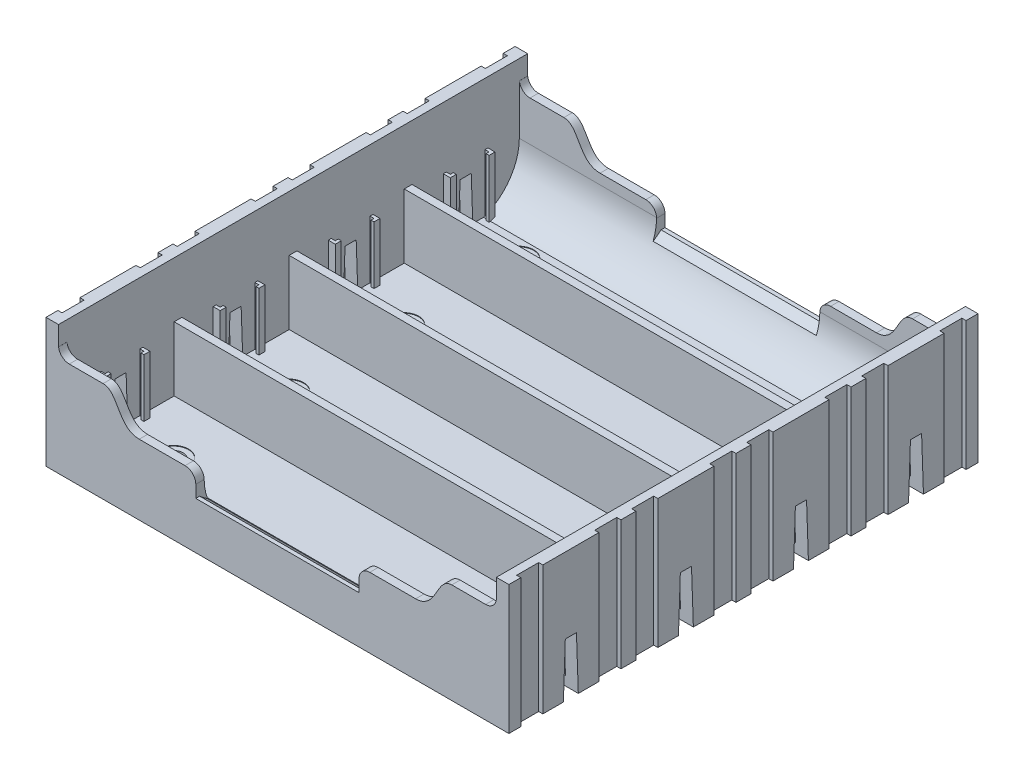
from build123d import *

# Parameters (mm, degrees)
EXTRUDE_1_DEPTH                  = 10.4
CUT_EXTRUDE_1_DEPTH              = 77.481335112
CUT_EXTRUDE_START                = -23.03
SKETCH_3_R                       = 15
CUT_EXTRUDE_2_DEPTH              = 27.39
SKETCH_17_W                      = 73.45
SKETCH_17_H                      = 1.574923167
EXTRUDE_12_DEPTH                 = 28.95
EXTRUDE_8_DEPTH                  = 21.65
EXTRUDE_9_DEPTH                  = 11.28
SKETCH_16_W                      = 3.39091882
SKETCH_16_H                      = 2.5
CUT_EXTRUDE_5_DEPTH              = 9
CUT_EXTRUDE_5_DRAFT              = -2
CUT_EXTRUDE_5_PROFILE_2_DEPTH    = 9
CUT_EXTRUDE_5_PROFILE_2_DRAFT    = -2
SKETCH_18_R                      = 1.6
CUT_EXTRUDE_6_DEPTH              = 9
SKETCH_21_R                      = 2.5
CUT_EXTRUDE_9_DEPTH              = 0.1
PATTERN_LINEAR_1_COUNT           = 4
PATTERN_LINEAR_1_PITCH           = 19.3
PATTERN_LINEAR_1_COPY_1_SKETCH_W = 3.39091882
PATTERN_LINEAR_1_COPY_1_SKETCH_H = 2.5
PATTERN_LINEAR_1_COPY_1_DEPTH    = 9
PATTERN_LINEAR_1_COPY_1_DRAFT    = -2
PATTERN_LINEAR_1_COPY_2_SKETCH_W = 3.39091882
PATTERN_LINEAR_1_COPY_2_SKETCH_H = 2.5
PATTERN_LINEAR_1_COPY_2_DEPTH    = 9
PATTERN_LINEAR_1_COPY_2_DRAFT    = -2
PATTERN_LINEAR_1_COPY_3_SKETCH_W = 3.39091882
PATTERN_LINEAR_1_COPY_3_SKETCH_H = 2.5
PATTERN_LINEAR_1_COPY_3_DEPTH    = 9
PATTERN_LINEAR_1_COPY_3_DRAFT    = -2
PATTERN_LINEAR_1_COPY_4_SKETCH_W = 3.39091882
PATTERN_LINEAR_1_COPY_4_SKETCH_H = 2.5
PATTERN_LINEAR_1_COPY_4_DEPTH    = 9
PATTERN_LINEAR_1_COPY_4_DRAFT    = -2
PATTERN_LINEAR_1_COPY_5_SKETCH_W = 3.39091882
PATTERN_LINEAR_1_COPY_5_SKETCH_H = 2.5
PATTERN_LINEAR_1_COPY_5_DEPTH    = 9
PATTERN_LINEAR_1_COPY_5_DRAFT    = -2
PATTERN_LINEAR_1_COPY_6_SKETCH_W = 3.39091882
PATTERN_LINEAR_1_COPY_6_SKETCH_H = 2.5
PATTERN_LINEAR_1_COPY_6_DEPTH    = 9
PATTERN_LINEAR_1_COPY_6_DRAFT    = -2
PATTERN_LINEAR_1_COPY_7_SKETCH_W = 3.39091882
PATTERN_LINEAR_1_COPY_7_SKETCH_H = 2.5
PATTERN_LINEAR_1_COPY_7_DEPTH    = 9
PATTERN_LINEAR_1_COPY_7_DRAFT    = -2
PATTERN_LINEAR_1_COPY_8_SKETCH_W = 3.39091882
PATTERN_LINEAR_1_COPY_8_SKETCH_H = 2.5
PATTERN_LINEAR_1_COPY_8_DEPTH    = 9
PATTERN_LINEAR_1_COPY_8_DRAFT    = -2
PATTERN_LINEAR_1_COPY_9_SKETCH_W = 3.39091882
PATTERN_LINEAR_1_COPY_9_SKETCH_H = 2.5
PATTERN_LINEAR_1_COPY_9_DEPTH    = 9
PATTERN_LINEAR_1_COPY_9_DRAFT    = -2
EXTRUDE_START                    = -9.3
SKETCH_13_W                      = 76.887886028
SKETCH_13_H                      = 1.3
EXTRUDE_10_DEPTH                 = 10.775076833
PATTERN_LINEAR_4_COUNT           = 3
PATTERN_LINEAR_4_PITCH           = 19.3


with BuildPart() as part:
    # Эскиз1 → Бобышка-Вытянуть1 (new body)
    with BuildSketch(Plane.XY):
        with BuildLine():
            Line((-36.725, 0), (36.725, 0))
            Line((36.725, 0), (36.725, 18.61))
            ThreePointArc((36.725, 18.61), (36.197792206, 17.337207794), (34.925, 16.81))
            Line((34.925, 16.81), (29.245, 16.81))
            add(Edge.make_bspline(
                [(29.245, 16.81), (26.615660483, 16.785816988), (26.812848665, 11.78956424), (23.185, 11.76)],
                knots=[0, 0, 0, 0, 1, 1, 1, 1], degree=3))
            Line((23.185, 11.76), (15.495, 11.76))
            ThreePointArc((15.495, 11.76), (14.222207794, 11.232792206), (13.695, 9.96))
            Line((13.695, 9.96), (13.695, 7.9))
            Line((13.695, 7.9), (-13.695, 7.9))
            Line((-13.695, 7.9), (-13.695, 9.96))
            ThreePointArc((-13.695, 9.96), (-14.222207794, 11.232792206), (-15.495, 11.76))
            Line((-15.495, 11.76), (-23.185, 11.76))
            add(Edge.make_bspline(
                [(-29.245, 16.81), (-26.615660483, 16.785816988), (-26.812848665, 11.78956424), (-23.185, 11.76)],
                knots=[0, 0, 0, 0, 1, 1, 1, 1], degree=3))
            Line((-29.245, 16.81), (-34.925, 16.81))
            ThreePointArc((-34.925, 16.81), (-36.197792206, 17.337207794), (-36.725, 18.61))
            Line((-36.725, 18.61), (-36.725, 0))
        make_face()
    extrude(amount=-EXTRUDE_1_DEPTH)

    # Эскиз2 → Вырез-Вытянуть1 (cut, through all)
    with BuildSketch(Plane.ZY.offset(36.725)):
        with BuildLine():
            Line((0, 1.574923167), (-3, 1.574923167))
            ThreePointArc((-3, 1.574923167), (-7.348469228, 4.864052118), (-9, 10.060204541))
            Line((-9, 10.060204541), (-9, 18.405231898))
            Line((-9, 18.405231898), (-10.765680148, 18.405231898))
            Line((-10.765680148, 18.405231898), (-10.765680148, 19.973545767))
            Line((-10.765680148, 19.973545767), (0, 19.973545767))
            Line((0, 19.973545767), (0, 1.574923167))
        make_face()
    extrude(amount=-CUT_EXTRUDE_1_DEPTH, mode=Mode.SUBTRACT)

    # Эскиз3 → Вырез-Вытянуть2 (cut)
    with BuildSketch(Plane.ZY.offset(36.725).offset(CUT_EXTRUDE_START)):
        with Locations((0, 19.3)):
            Circle(SKETCH_3_R)
    extrude(amount=-CUT_EXTRUDE_2_DEPTH, mode=Mode.SUBTRACT)

    # Эскиз17 → Бобышка-Вытянуть12 (add)
    with BuildSketch(Plane.XY):
        with Locations((0, 0.787461584)):
            Rectangle(SKETCH_17_W, SKETCH_17_H)
    extrude(amount=EXTRUDE_12_DEPTH)

    # Зеркальное отражение7: part across plane


with BuildPart() as part_1:
    add(part.part)
    add(part.part.mirror(Plane.XY.offset(28.95)))

    # Эскиз5 → Бобышка-Вытянуть8 (add)
    with BuildSketch(Plane.XZ):
        Polygon((36.725, 10.4), (36.725, -10.4), (38.825, -10.4), (38.825, -8.4), (38.125, -8.4), (38.125, -4.7), (38.825, -4.7), (38.825, 4.7), (38.125, 4.7), (38.125, 8.4), (38.825, 8.4), (38.825, 10.4), align=None)
        Polygon((-38.125, 8.4), (-38.825, 8.4), (-38.825, 10.4), (-36.725, 10.4), (-36.725, -10.4), (-38.125, -10.4), (-38.825, -10.4), (-38.825, -8.4), (-38.125, -8.4), (-38.125, -4.7), (-38.825, -4.7), (-38.825, 4.7), (-38.125, 4.7), align=None)
    extrude_8 = extrude(amount=-EXTRUDE_8_DEPTH)

    # Эскиз4 → Бобышка-Вытянуть9 (add)
    with BuildSketch(Plane.XZ):
        Polygon((-36.05, -3.25), (-37.25, -3.25), (-37.25, -3.75), (-35.55, -3.75), (-35.55, -2.75), (-36.05, -2.75), align=None)
        Polygon((-36.05, 3.25), (-37.25, 3.25), (-37.25, 3.75), (-35.55, 3.75), (-35.55, 2.75), (-36.05, 2.75), align=None)
        Polygon((36.05, 2.75), (36.05, 3.25), (37.25, 3.25), (37.25, 3.75), (35.55, 3.75), (35.55, 2.75), align=None)
        Polygon((37.25, -3.75), (37.25, -3.25), (36.05, -3.25), (36.05, -2.75), (35.55, -2.75), (35.55, -3.75), align=None)
    extrude_9 = extrude(amount=-EXTRUDE_9_DEPTH)


with BuildPart() as cut_extrude_5_tool:
    # Эскиз16 → Вырез-Вытянуть5 (with draft: the straight prism first)
    with BuildSketch(Plane.XZ):
        with Locations((-37.74545941, 0)):
            Rectangle(SKETCH_16_W, SKETCH_16_H)
    extrude(amount=-CUT_EXTRUDE_5_DEPTH)
    # Вырез-Вытянуть5: the draft: its side faces are tilted about the plane it starts from
    cut_extrude_5_sides = [cut_extrude_5_tool.faces().sort_by_distance(p)[0] for p in [
        (-37.74545941, 4.5, 1.25),
        (-39.44091882, 4.5, 0),
        (-37.74545941, 4.5, -1.25),
        (-36.05, 4.5, 0),
    ]]
    draft(cut_extrude_5_sides, Plane.XZ, CUT_EXTRUDE_5_DRAFT)


with BuildPart() as part_2:
    add(part_1.part)

    # Вырез-Вытянуть5: cut by cut_extrude_5_tool
    add(cut_extrude_5_tool.part, mode=Mode.SUBTRACT)


with BuildPart() as cut_extrude_5_profile_2_tool:
    # Эскиз16 → Вырез-Вытянуть5 profile 2 (with draft: the straight prism first)
    with BuildSketch(Plane.XZ):
        with Locations((37.74545941, 0)):
            Rectangle(SKETCH_16_W, SKETCH_16_H)
    extrude(amount=-CUT_EXTRUDE_5_PROFILE_2_DEPTH)
    # Вырез-Вытянуть5 profile 2: the draft: its side faces are tilted about the plane it starts from
    cut_extrude_5_profile_2_sides = [cut_extrude_5_profile_2_tool.faces().sort_by_distance(p)[0] for p in [
        (37.74545941, 4.5, 1.25),
        (36.05, 4.5, 0),
        (37.74545941, 4.5, -1.25),
        (39.44091882, 4.5, 0),
    ]]
    draft(cut_extrude_5_profile_2_sides, Plane.XZ, CUT_EXTRUDE_5_PROFILE_2_DRAFT)


with BuildPart() as part_3:
    add(part_2.part)

    # Вырез-Вытянуть5 profile 2: cut by cut_extrude_5_profile_2_tool
    add(cut_extrude_5_profile_2_tool.part, mode=Mode.SUBTRACT)

    # Эскиз18 → Вырез-Вытянуть6 (cut)
    with BuildSketch(Plane.XZ):
        with Locations((-27.81, 0)):
            Circle(SKETCH_18_R)
        with Locations((27.81, 0)):
            Circle(SKETCH_18_R)
    cut_extrude_6 = extrude(amount=-CUT_EXTRUDE_6_DEPTH, mode=Mode.SUBTRACT)

    # Эскиз21 → Вырез-Вытянуть9 (cut)
    with BuildSketch(Plane(origin=(0, 1.574923167, 0), x_dir=(1, 0, 0), z_dir=(0, 1, 0))):
        with Locations(Location((27.81, 0, 0), (0, 0, 270))):
            Circle(SKETCH_21_R)
        with Locations(Location((-27.81, 0, 0), (0, 0, 270))):
            Circle(SKETCH_21_R)
    cut_extrude_9 = extrude(amount=-CUT_EXTRUDE_9_DEPTH, mode=Mode.SUBTRACT)

    # Линейный массив1: Бобышка-Вытянуть8, Бобышка-Вытянуть9, Вырез-Вытянуть6, Вырез-Вытянуть9 ×4
    with Locations(*[(0, 0, i * PATTERN_LINEAR_1_PITCH) for i in range(1, PATTERN_LINEAR_1_COUNT)]):
        add(extrude_8)
        add(extrude_9)
        add(cut_extrude_6, mode=Mode.SUBTRACT)
        add(cut_extrude_9, mode=Mode.SUBTRACT)


with BuildPart() as pattern_linear_1_copy_1_tool:
    # Линейный массив1 copy 1 sketch → Линейный массив1 copy 1 (with draft: the straight prism first)
    with BuildSketch(Plane(origin=(0, 0, 19.3), x_dir=(1, 0, 0), z_dir=(0, -1, 0))):
        with Locations((-37.74545941, 0)):
            Rectangle(PATTERN_LINEAR_1_COPY_1_SKETCH_W, PATTERN_LINEAR_1_COPY_1_SKETCH_H)
    extrude(amount=-PATTERN_LINEAR_1_COPY_1_DEPTH)
    # Линейный массив1 copy 1: the draft: its side faces are tilted about the plane it starts from
    pattern_linear_1_copy_1_sides = [pattern_linear_1_copy_1_tool.faces().sort_by_distance(p)[0] for p in [
        (-37.74545941, 4.5, 20.55),
        (-39.44091882, 4.5, 19.3),
        (-37.74545941, 4.5, 18.05),
        (-36.05, 4.5, 19.3),
    ]]
    draft(pattern_linear_1_copy_1_sides, Plane(origin=(0, 0, 19.3), x_dir=(1, 0, 0), z_dir=(0, -1, 0)), PATTERN_LINEAR_1_COPY_1_DRAFT)


with BuildPart() as part_4:
    add(part_3.part)

    # Линейный массив1 copy 1: cut by pattern_linear_1_copy_1_tool
    add(pattern_linear_1_copy_1_tool.part, mode=Mode.SUBTRACT)


with BuildPart() as pattern_linear_1_copy_2_tool:
    # Линейный массив1 copy 2 sketch → Линейный массив1 copy 2 (with draft: the straight prism first)
    with BuildSketch(Plane(origin=(0, 0, 38.6), x_dir=(1, 0, 0), z_dir=(0, -1, 0))):
        with Locations((-37.74545941, 0)):
            Rectangle(PATTERN_LINEAR_1_COPY_2_SKETCH_W, PATTERN_LINEAR_1_COPY_2_SKETCH_H)
    extrude(amount=-PATTERN_LINEAR_1_COPY_2_DEPTH)
    # Линейный массив1 copy 2: the draft: its side faces are tilted about the plane it starts from
    pattern_linear_1_copy_2_sides = [pattern_linear_1_copy_2_tool.faces().sort_by_distance(p)[0] for p in [
        (-37.74545941, 4.5, 39.85),
        (-39.44091882, 4.5, 38.6),
        (-37.74545941, 4.5, 37.35),
        (-36.05, 4.5, 38.6),
    ]]
    draft(pattern_linear_1_copy_2_sides, Plane(origin=(0, 0, 38.6), x_dir=(1, 0, 0), z_dir=(0, -1, 0)), PATTERN_LINEAR_1_COPY_2_DRAFT)


with BuildPart() as part_5:
    add(part_4.part)

    # Линейный массив1 copy 2: cut by pattern_linear_1_copy_2_tool
    add(pattern_linear_1_copy_2_tool.part, mode=Mode.SUBTRACT)


with BuildPart() as pattern_linear_1_copy_3_tool:
    # Линейный массив1 copy 3 sketch → Линейный массив1 copy 3 (with draft: the straight prism first)
    with BuildSketch(Plane(origin=(0, 0, 57.9), x_dir=(1, 0, 0), z_dir=(0, -1, 0))):
        with Locations((-37.74545941, 0)):
            Rectangle(PATTERN_LINEAR_1_COPY_3_SKETCH_W, PATTERN_LINEAR_1_COPY_3_SKETCH_H)
    extrude(amount=-PATTERN_LINEAR_1_COPY_3_DEPTH)
    # Линейный массив1 copy 3: the draft: its side faces are tilted about the plane it starts from
    pattern_linear_1_copy_3_sides = [pattern_linear_1_copy_3_tool.faces().sort_by_distance(p)[0] for p in [
        (-37.74545941, 4.5, 59.15),
        (-39.44091882, 4.5, 57.9),
        (-37.74545941, 4.5, 56.65),
        (-36.05, 4.5, 57.9),
    ]]
    draft(pattern_linear_1_copy_3_sides, Plane(origin=(0, 0, 57.9), x_dir=(1, 0, 0), z_dir=(0, -1, 0)), PATTERN_LINEAR_1_COPY_3_DRAFT)


with BuildPart() as part_6:
    add(part_5.part)

    # Линейный массив1 copy 3: cut by pattern_linear_1_copy_3_tool
    add(pattern_linear_1_copy_3_tool.part, mode=Mode.SUBTRACT)


with BuildPart() as pattern_linear_1_copy_4_tool:
    # Линейный массив1 copy 4 sketch → Линейный массив1 copy 4 (with draft: the straight prism first)
    with BuildSketch(Plane(origin=(0, 0, 19.3), x_dir=(1, 0, 0), z_dir=(0, -1, 0))):
        with Locations((37.74545941, 0)):
            Rectangle(PATTERN_LINEAR_1_COPY_4_SKETCH_W, PATTERN_LINEAR_1_COPY_4_SKETCH_H)
    extrude(amount=-PATTERN_LINEAR_1_COPY_4_DEPTH)
    # Линейный массив1 copy 4: the draft: its side faces are tilted about the plane it starts from
    pattern_linear_1_copy_4_sides = [pattern_linear_1_copy_4_tool.faces().sort_by_distance(p)[0] for p in [
        (37.74545941, 4.5, 20.55),
        (36.05, 4.5, 19.3),
        (37.74545941, 4.5, 18.05),
        (39.44091882, 4.5, 19.3),
    ]]
    draft(pattern_linear_1_copy_4_sides, Plane(origin=(0, 0, 19.3), x_dir=(1, 0, 0), z_dir=(0, -1, 0)), PATTERN_LINEAR_1_COPY_4_DRAFT)


with BuildPart() as part_7:
    add(part_6.part)

    # Линейный массив1 copy 4: cut by pattern_linear_1_copy_4_tool
    add(pattern_linear_1_copy_4_tool.part, mode=Mode.SUBTRACT)


with BuildPart() as pattern_linear_1_copy_5_tool:
    # Линейный массив1 copy 5 sketch → Линейный массив1 copy 5 (with draft: the straight prism first)
    with BuildSketch(Plane(origin=(0, 0, 38.6), x_dir=(1, 0, 0), z_dir=(0, -1, 0))):
        with Locations((37.74545941, 0)):
            Rectangle(PATTERN_LINEAR_1_COPY_5_SKETCH_W, PATTERN_LINEAR_1_COPY_5_SKETCH_H)
    extrude(amount=-PATTERN_LINEAR_1_COPY_5_DEPTH)
    # Линейный массив1 copy 5: the draft: its side faces are tilted about the plane it starts from
    pattern_linear_1_copy_5_sides = [pattern_linear_1_copy_5_tool.faces().sort_by_distance(p)[0] for p in [
        (37.74545941, 4.5, 39.85),
        (36.05, 4.5, 38.6),
        (37.74545941, 4.5, 37.35),
        (39.44091882, 4.5, 38.6),
    ]]
    draft(pattern_linear_1_copy_5_sides, Plane(origin=(0, 0, 38.6), x_dir=(1, 0, 0), z_dir=(0, -1, 0)), PATTERN_LINEAR_1_COPY_5_DRAFT)


with BuildPart() as part_8:
    add(part_7.part)

    # Линейный массив1 copy 5: cut by pattern_linear_1_copy_5_tool
    add(pattern_linear_1_copy_5_tool.part, mode=Mode.SUBTRACT)


with BuildPart() as pattern_linear_1_copy_6_tool:
    # Линейный массив1 copy 6 sketch → Линейный массив1 copy 6 (with draft: the straight prism first)
    with BuildSketch(Plane(origin=(0, 0, 57.9), x_dir=(1, 0, 0), z_dir=(0, -1, 0))):
        with Locations((37.74545941, 0)):
            Rectangle(PATTERN_LINEAR_1_COPY_6_SKETCH_W, PATTERN_LINEAR_1_COPY_6_SKETCH_H)
    extrude(amount=-PATTERN_LINEAR_1_COPY_6_DEPTH)
    # Линейный массив1 copy 6: the draft: its side faces are tilted about the plane it starts from
    pattern_linear_1_copy_6_sides = [pattern_linear_1_copy_6_tool.faces().sort_by_distance(p)[0] for p in [
        (37.74545941, 4.5, 59.15),
        (36.05, 4.5, 57.9),
        (37.74545941, 4.5, 56.65),
        (39.44091882, 4.5, 57.9),
    ]]
    draft(pattern_linear_1_copy_6_sides, Plane(origin=(0, 0, 57.9), x_dir=(1, 0, 0), z_dir=(0, -1, 0)), PATTERN_LINEAR_1_COPY_6_DRAFT)


with BuildPart() as part_9:
    add(part_8.part)

    # Линейный массив1 copy 6: cut by pattern_linear_1_copy_6_tool
    add(pattern_linear_1_copy_6_tool.part, mode=Mode.SUBTRACT)


with BuildPart() as pattern_linear_1_copy_7_tool:
    # Линейный массив1 copy 7 sketch → Линейный массив1 copy 7 (with draft: the straight prism first)
    with BuildSketch(Plane(origin=(0, 0, 19.3), x_dir=(1, 0, 0), z_dir=(0, -1, 0))):
        with Locations((37.74545941, 0)):
            Rectangle(PATTERN_LINEAR_1_COPY_7_SKETCH_W, PATTERN_LINEAR_1_COPY_7_SKETCH_H)
    extrude(amount=-PATTERN_LINEAR_1_COPY_7_DEPTH)
    # Линейный массив1 copy 7: the draft: its side faces are tilted about the plane it starts from
    pattern_linear_1_copy_7_sides = [pattern_linear_1_copy_7_tool.faces().sort_by_distance(p)[0] for p in [
        (37.74545941, 4.5, 20.55),
        (36.05, 4.5, 19.3),
        (37.74545941, 4.5, 18.05),
        (39.44091882, 4.5, 19.3),
    ]]
    draft(pattern_linear_1_copy_7_sides, Plane(origin=(0, 0, 19.3), x_dir=(1, 0, 0), z_dir=(0, -1, 0)), PATTERN_LINEAR_1_COPY_7_DRAFT)


with BuildPart() as part_10:
    add(part_9.part)

    # Линейный массив1 copy 7: cut by pattern_linear_1_copy_7_tool
    add(pattern_linear_1_copy_7_tool.part, mode=Mode.SUBTRACT)


with BuildPart() as pattern_linear_1_copy_8_tool:
    # Линейный массив1 copy 8 sketch → Линейный массив1 copy 8 (with draft: the straight prism first)
    with BuildSketch(Plane(origin=(0, 0, 38.6), x_dir=(1, 0, 0), z_dir=(0, -1, 0))):
        with Locations((37.74545941, 0)):
            Rectangle(PATTERN_LINEAR_1_COPY_8_SKETCH_W, PATTERN_LINEAR_1_COPY_8_SKETCH_H)
    extrude(amount=-PATTERN_LINEAR_1_COPY_8_DEPTH)
    # Линейный массив1 copy 8: the draft: its side faces are tilted about the plane it starts from
    pattern_linear_1_copy_8_sides = [pattern_linear_1_copy_8_tool.faces().sort_by_distance(p)[0] for p in [
        (37.74545941, 4.5, 39.85),
        (36.05, 4.5, 38.6),
        (37.74545941, 4.5, 37.35),
        (39.44091882, 4.5, 38.6),
    ]]
    draft(pattern_linear_1_copy_8_sides, Plane(origin=(0, 0, 38.6), x_dir=(1, 0, 0), z_dir=(0, -1, 0)), PATTERN_LINEAR_1_COPY_8_DRAFT)


with BuildPart() as part_11:
    add(part_10.part)

    # Линейный массив1 copy 8: cut by pattern_linear_1_copy_8_tool
    add(pattern_linear_1_copy_8_tool.part, mode=Mode.SUBTRACT)


with BuildPart() as pattern_linear_1_copy_9_tool:
    # Линейный массив1 copy 9 sketch → Линейный массив1 copy 9 (with draft: the straight prism first)
    with BuildSketch(Plane(origin=(0, 0, 57.9), x_dir=(1, 0, 0), z_dir=(0, -1, 0))):
        with Locations((37.74545941, 0)):
            Rectangle(PATTERN_LINEAR_1_COPY_9_SKETCH_W, PATTERN_LINEAR_1_COPY_9_SKETCH_H)
    extrude(amount=-PATTERN_LINEAR_1_COPY_9_DEPTH)
    # Линейный массив1 copy 9: the draft: its side faces are tilted about the plane it starts from
    pattern_linear_1_copy_9_sides = [pattern_linear_1_copy_9_tool.faces().sort_by_distance(p)[0] for p in [
        (37.74545941, 4.5, 59.15),
        (36.05, 4.5, 57.9),
        (37.74545941, 4.5, 56.65),
        (39.44091882, 4.5, 57.9),
    ]]
    draft(pattern_linear_1_copy_9_sides, Plane(origin=(0, 0, 57.9), x_dir=(1, 0, 0), z_dir=(0, -1, 0)), PATTERN_LINEAR_1_COPY_9_DRAFT)


with BuildPart() as part_12:
    add(part_11.part)

    # Линейный массив1 copy 9: cut by pattern_linear_1_copy_9_tool
    add(pattern_linear_1_copy_9_tool.part, mode=Mode.SUBTRACT)

    # Эскиз13 → Бобышка-Вытянуть10 (add)
    with BuildSketch(Plane(origin=(0, 21.65, 0), x_dir=(1, 0, 0), z_dir=(0, 1, 0)).offset(EXTRUDE_START)):
        with Locations((0.050513843, -9.655764363)):
            Rectangle(SKETCH_13_W, SKETCH_13_H)
    extrude_10 = extrude(amount=-EXTRUDE_10_DEPTH)

    # Линейный массив4: Бобышка-Вытянуть10 ×3
    with Locations(*[(0, 0, i * PATTERN_LINEAR_4_PITCH) for i in range(1, PATTERN_LINEAR_4_COUNT)]):
        add(extrude_10)


solid = part_12.part
